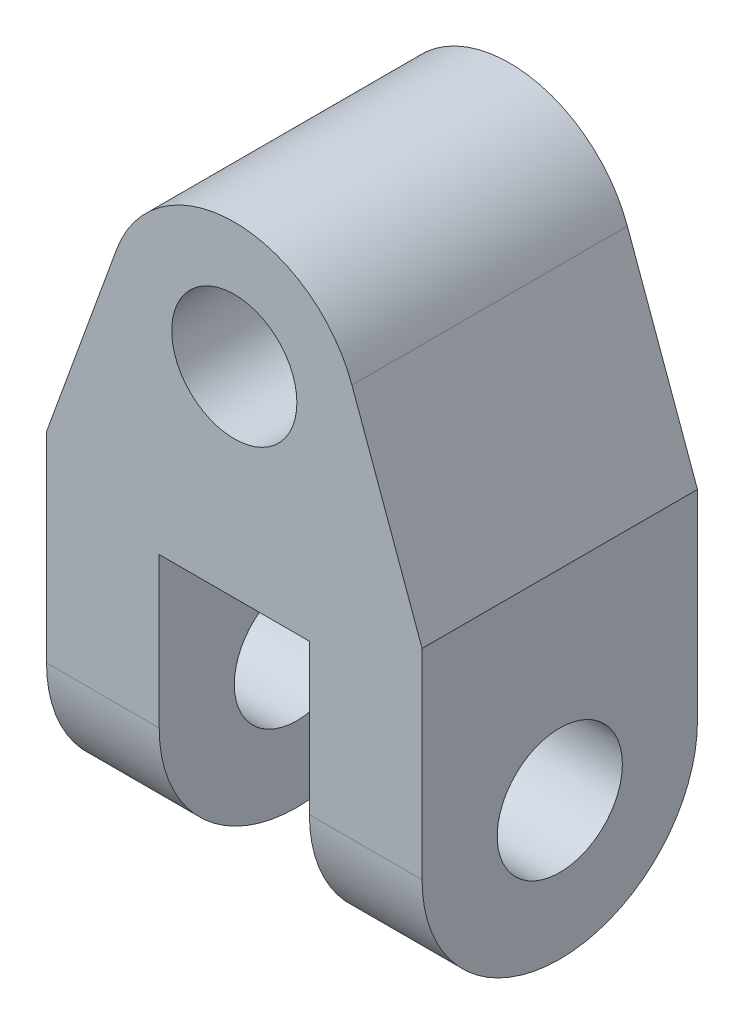
from build123d import *

# Parameters (mm, degrees)
SKETCH1_R           = 10000
BOSS_EXTRUDE3_DEPTH = 44000
SKETCH2_R           = 10000
CUT_EXTRUDE1_DEPTH  = 107797.103825695
CUT_EXTRUDE2_DEPTH  = 107797.103825695


with BuildPart() as part:
    # Sketch1 → Boss-Extrude3 (new body)
    with BuildSketch(Plane.XY):
        with BuildLine():
            Line((-30000, -24000), (-30000, -78000))
            Line((-30000, -78000), (-12000, -78000))
            Line((-12000, -78000), (-12000, -32000))
            Line((-12000, -32000), (12000, -32000))
            Line((12000, -32000), (12000, -78000))
            Line((12000, -78000), (30000, -78000))
            Line((30000, -78000), (30000, -24000))
            Line((30000, -24000), (18797.541116655, 6830.259729152))
            ThreePointArc((18797.541116655, 6830.259729152), (0, 20000), (-18797.541116655, 6830.259729152))
            Line((-18797.541116655, 6830.259729152), (-30000, -24000))
        make_face()
        Circle(SKETCH1_R, mode=Mode.SUBTRACT)
    extrude(amount=BOSS_EXTRUDE3_DEPTH)

    # Sketch2 → Cut-Extrude1 (cut, through all)
    with BuildSketch(Plane(origin=(30000, 0, 0), x_dir=(0, 0, -1), z_dir=(1, 0, 0))):
        with Locations((-22000, -56000)):
            Circle(SKETCH2_R)
    extrude(amount=-CUT_EXTRUDE1_DEPTH, mode=Mode.SUBTRACT)

    # Sketch3 → Cut-Extrude2 (cut, through all)
    with BuildSketch(Plane(origin=(30000, 0, 0), x_dir=(0, 0, -1), z_dir=(1, 0, 0))):
        with BuildLine():
            Line((-44000, -78000), (-22000, -78000))
            ThreePointArc((-22000, -78000), (-37556.349186104, -71556.349186104), (-44000, -56000))
            Line((-44000, -56000), (-44000, -78000))
        make_face()
        with BuildLine():
            Line((-22000, -78000), (0, -78000))
            Line((0, -78000), (0, -56000))
            ThreePointArc((0, -56000), (-6443.650813896, -71556.349186104), (-22000, -78000))
        make_face()
    extrude(amount=-CUT_EXTRUDE2_DEPTH, mode=Mode.SUBTRACT)


solid = part.part
